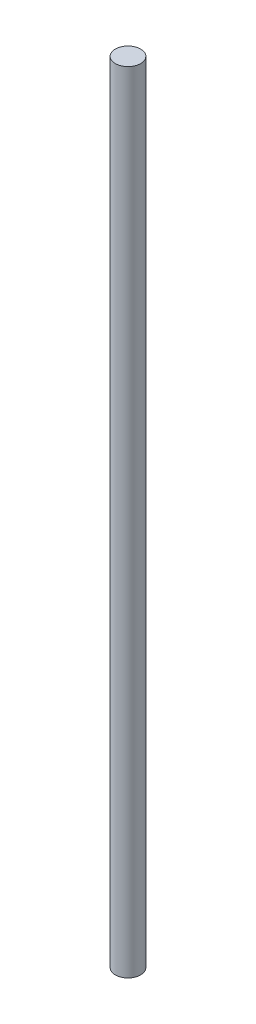
from build123d import *

# Parameters (mm, degrees)
SCHIZZO1_R                   = 4
ESTRUSIONE_ESTRUSIONE1_DEPTH = 250


with BuildPart() as part:
    # Schizzo1 → Estrusione-Estrusione1 (new body)
    with BuildSketch(Plane(origin=(0, 0, 0), x_dir=(1, 0, 0), z_dir=(0, 1, 0))):
        with Locations(Location((0, 0, 0), (0, 0, 270))):
            Circle(SCHIZZO1_R)
    extrude(amount=ESTRUSIONE_ESTRUSIONE1_DEPTH)


solid = part.part
